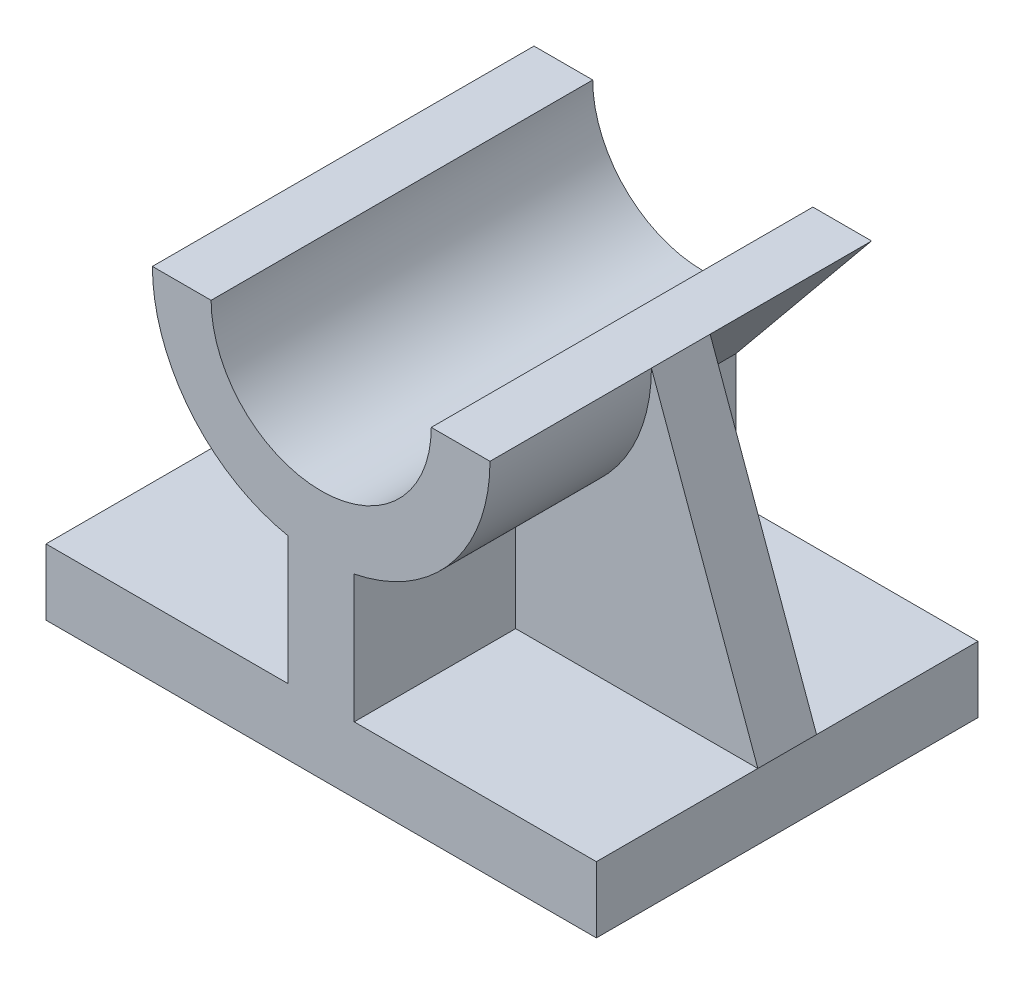
from build123d import *

# Parameters (mm, degrees)
BOSS_EXTRUDE3_DEPTH = 52
BOSS_EXTRUDE4_DEPTH = 30
CUT_EXTRUDE1_DEPTH  = 22


with BuildPart() as part:
    # Sketch4 → Boss-Extrude3 (new body)
    with BuildSketch(Plane.XY):
        with BuildLine():
            Line((-37.5, 4.5), (-4.5, 4.5))
            Line((-4.5, 4.5), (-4.5, 21.944512863))
            ThreePointArc((-4.5, 21.944512863), (-17.783419244, 29.914047854), (-23, 44.5))
            Line((-23, 44.5), (-15, 44.5))
            ThreePointArc((-15, 44.5), (0, 29.5), (15, 44.5))
            Line((15, 44.5), (23, 44.5))
            ThreePointArc((23, 44.5), (17.783419244, 29.914047854), (4.5, 21.944512863))
            Line((4.5, 21.944512863), (4.5, 4.5))
            Line((4.5, 4.5), (37.5, 4.5))
            Line((37.5, 4.5), (37.5, -4.5))
            Line((37.5, -4.5), (-37.5, -4.5))
            Line((-37.5, -4.5), (-37.5, 4.5))
        make_face()
    extrude(amount=BOSS_EXTRUDE3_DEPTH)

    # Sketch5 → Boss-Extrude4 (add)
    with BuildSketch(Plane.XY):
        Polygon((4.5, 4.5), (37.5, 4.5), (23, 44.5), (4.5, 21.944512863), align=None)
    extrude(amount=BOSS_EXTRUDE4_DEPTH)

    # Sketch5<2> → Cut-Extrude1 (cut)
    with BuildSketch(Plane.XY):
        Polygon((4.5, 4.5), (37.5, 4.5), (23, 44.5), (4.5, 21.944512863), align=None)
    extrude(amount=CUT_EXTRUDE1_DEPTH, mode=Mode.SUBTRACT)


solid = part.part
